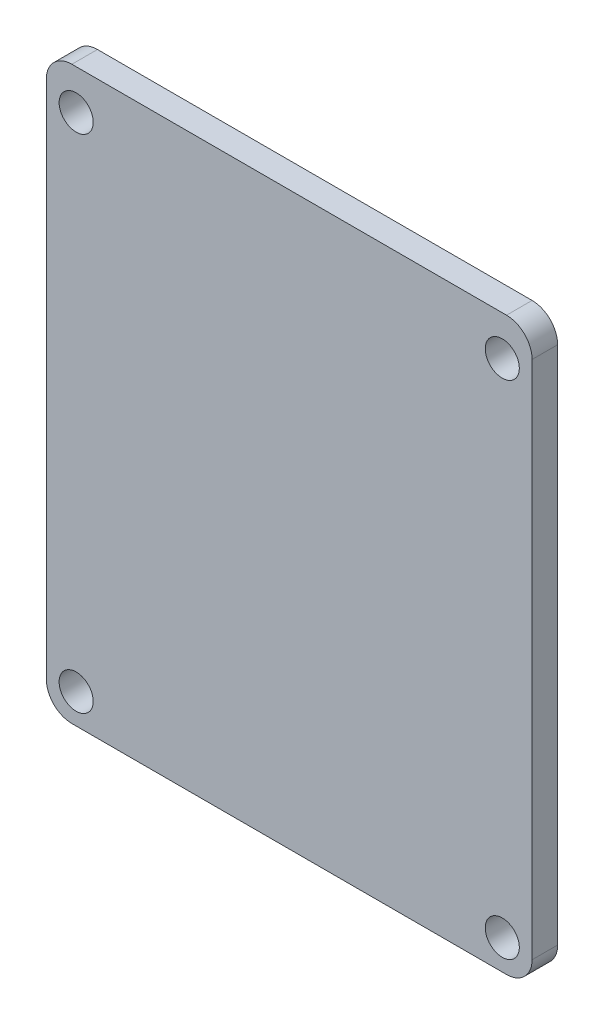
from build123d import *

# Parameters (mm, degrees)
SKICA1_W                = 57
SKICA1_H                = 67
SKICA1_R                = 2
P_IDAT_VYSUNUT_M1_DEPTH = 3
P_IDAT_VYSUNUT_M2_DEPTH = 1
ZAOBLIT1_R              = 3


with BuildPart() as part:
    # Skica1 → Přidat vysunutím1 (new body)
    with BuildSketch(Plane.XY):
        with Locations((28.5, 33.5)):
            Rectangle(SKICA1_W, SKICA1_H)
        with Locations((3.5, 62.35016579)):
            Circle(SKICA1_R, mode=Mode.SUBTRACT)
        with Locations((53.5, 62.35016579)):
            Circle(SKICA1_R, mode=Mode.SUBTRACT)
        with Locations((53.5, 3.5)):
            Circle(SKICA1_R, mode=Mode.SUBTRACT)
        with Locations((3.5, 3.5)):
            Circle(SKICA1_R, mode=Mode.SUBTRACT)
    extrude(amount=P_IDAT_VYSUNUT_M1_DEPTH)

    # Skica2 → Přidat vysunutím2 (add)
    with BuildSketch(Plane(origin=(0, 0, 0), x_dir=(-1, 0, 0), z_dir=(0, 0, -1))):
        Polygon((-41.396588298, 31.388427372), (-41.396588298, 33.183299167), (-23.447870349, 33.183299167), (-23.447870349, 40.87560686), (-21.396588298, 40.87560686), (-21.396588298, 31.388427372), align=None)
    extrude(amount=P_IDAT_VYSUNUT_M2_DEPTH)

    # Zaoblit1
    zaoblit1_edges = [part.edges().sort_by_distance(p)[0] for p in [
        (0, 67, 1.5),
        (57, 67, 1.5),
        (57, 0, 1.5),
        (0, 0, 1.5),
    ]]
    fillet(zaoblit1_edges, radius=ZAOBLIT1_R)


solid = part.part
